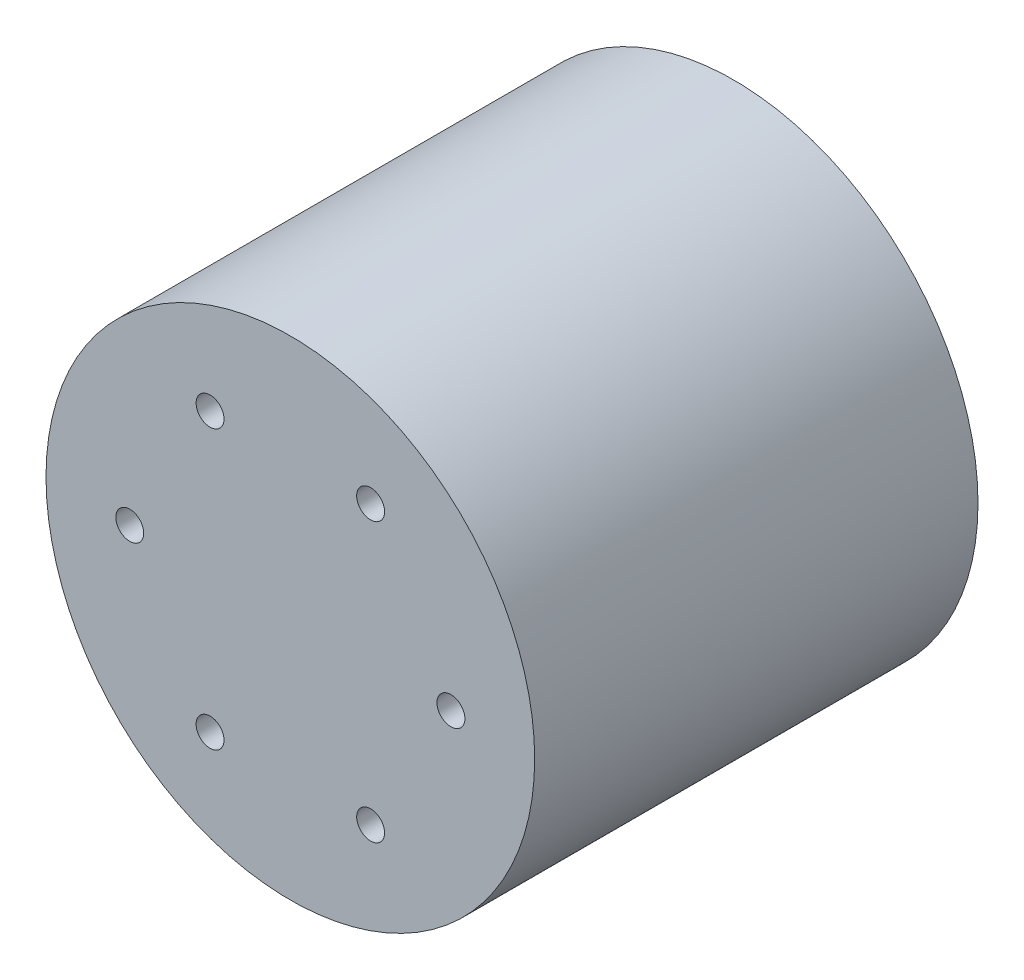
from build123d import *

# Parameters (mm, degrees)
SKETCH_1_R          = 35
EXTRUDE_2_DEPTH     = 63.5
SKETCH_3_R          = 2
CUT_EXTRUDE_1_DEPTH = 20


with BuildPart() as part:
    # 草图1 → 凸台-拉伸2 (new body)
    with BuildSketch(Plane.XY):
        Circle(SKETCH_1_R)
    extrude(amount=EXTRUDE_2_DEPTH)

    # 草图3 → 切除-拉伸1 (cut)
    with BuildSketch(Plane.XY.offset(63.5)):
        with Locations((-23, 0)):
            Circle(SKETCH_3_R)
        with Locations((-11.5, 19.918584287)):
            Circle(SKETCH_3_R)
        with Locations((11.5, 19.918584287)):
            Circle(SKETCH_3_R)
        with Locations((23, 0)):
            Circle(SKETCH_3_R)
        with Locations((11.5, -19.918584287)):
            Circle(SKETCH_3_R)
        with Locations((-11.5, -19.918584287)):
            Circle(SKETCH_3_R)
    cut_extrude_1 = extrude(amount=-CUT_EXTRUDE_1_DEPTH, mode=Mode.SUBTRACT)

    # 镜向1: 切除-拉伸1 across plane
    add(cut_extrude_1.mirror(Plane.XY.offset(31.75)), mode=Mode.SUBTRACT)


solid = part.part
